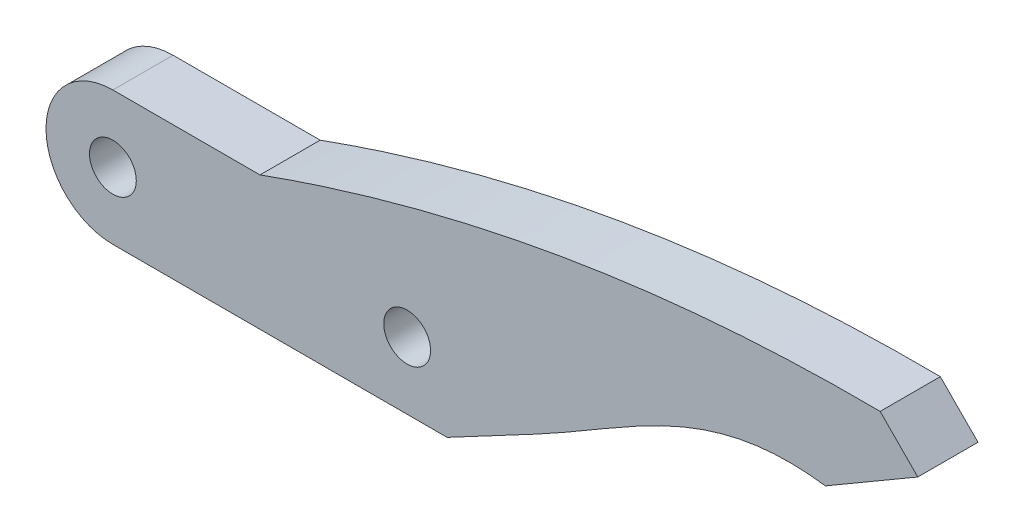
from build123d import *

# Parameters (mm, degrees)
SKETCH1_R           = 5
SKETCH1_R_2         = 1.75
BOSS_EXTRUDE1_DEPTH = 4.5
BOSS_EXTRUDE2_START = -4.5
BOSS_EXTRUDE2_DEPTH = 4.5


with BuildPart() as part:
    # Sketch1 → Boss-Extrude1 (new body)
    # profile 1 of 3: a face of its own
    with BuildSketch(Plane.XY):
        with Locations((-11, 0)):
            Circle(SKETCH1_R)
        with Locations((-11, 0)):
            Circle(SKETCH1_R_2, mode=Mode.SUBTRACT)
    # profile 2 of 3: a face of its own
    with BuildSketch(Plane.XY):
        with Locations((11, 0)):
            Circle(SKETCH1_R)
        with Locations((11, 0)):
            Circle(SKETCH1_R_2, mode=Mode.SUBTRACT)
    # profile 3 of 3: a face of its own
    with BuildSketch(Plane.XY):
        with BuildLine():
            Line((11.000000039, 5), (-11, 5))
            ThreePointArc((-11, 5), (-7.464466094, 3.535533906), (-6, 0))
            ThreePointArc((-6, 0), (-7.464466094, -3.535533906), (-11, -5))
            Line((-11, -5), (10.999999969, -5))
            ThreePointArc((10.999999969, -5), (6, 3.5e-08), (11.000000039, 5))
        make_face()
    extrude(amount=BOSS_EXTRUDE1_DEPTH)

    # Sketch2 → Boss-Extrude2 (add)
    with BuildSketch(Plane.XY.offset(4.5).offset(BOSS_EXTRUDE2_START)):
        with BuildLine():
            Line((46.363989199, 12.87), (49.180795902, 10.03))
            Line((49.180795902, 10.03), (42.27, 6))
            add(Edge.make_bspline(
                [(42.27, 6), (33.457840426, 7.213673904), (27.801569406, 2.343916059), (20.61, -1.48)],
                knots=[0, 0, 0, 0, 1, 1, 1, 1], degree=3))
            Line((20.61, -1.48), (13.99, -5))
            Line((13.99, -5), (11, -5))
            ThreePointArc((11, -5), (16, 0), (11, 5))
            Line((11, 5), (0, 5))
            add(Edge.make_bspline(
                [(0, 5), (22.387497142, 13.115081385), (46.363989199, 12.87)],
                knots=[0, 0, 0, 1, 1, 1], degree=2))
        make_face()
    extrude(amount=BOSS_EXTRUDE2_DEPTH)


solid = part.part
